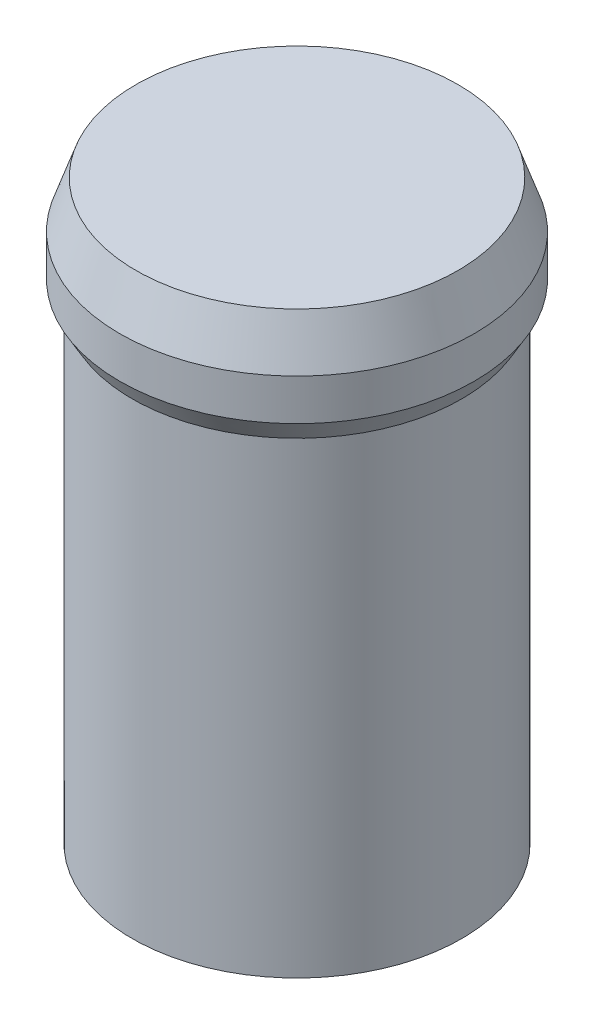
from build123d import *


with BuildPart() as part:
    # Sketch1 → Revolve1 (revolve)
    with BuildSketch(Plane.XY, mode=Mode.PRIVATE) as revolve1_sk:
        Polygon((20, 0), (20, 56.727116956), (21.5, 59.325193167), (21.5, 64.325193167), (19.547262907, 69.998535907), (0, 69.998535907), (0, 2.4), (6.7, 2.4), (6.7, 1.15), (19, 1.15), (19, 0), align=None)
    revolve(revolve1_sk.sketch.rotate(Axis((0, 2.4, 0), (0, 1, 0)), 90), axis=Axis((0, 2.4, 0), (0, 1, 0)))


solid = part.part
